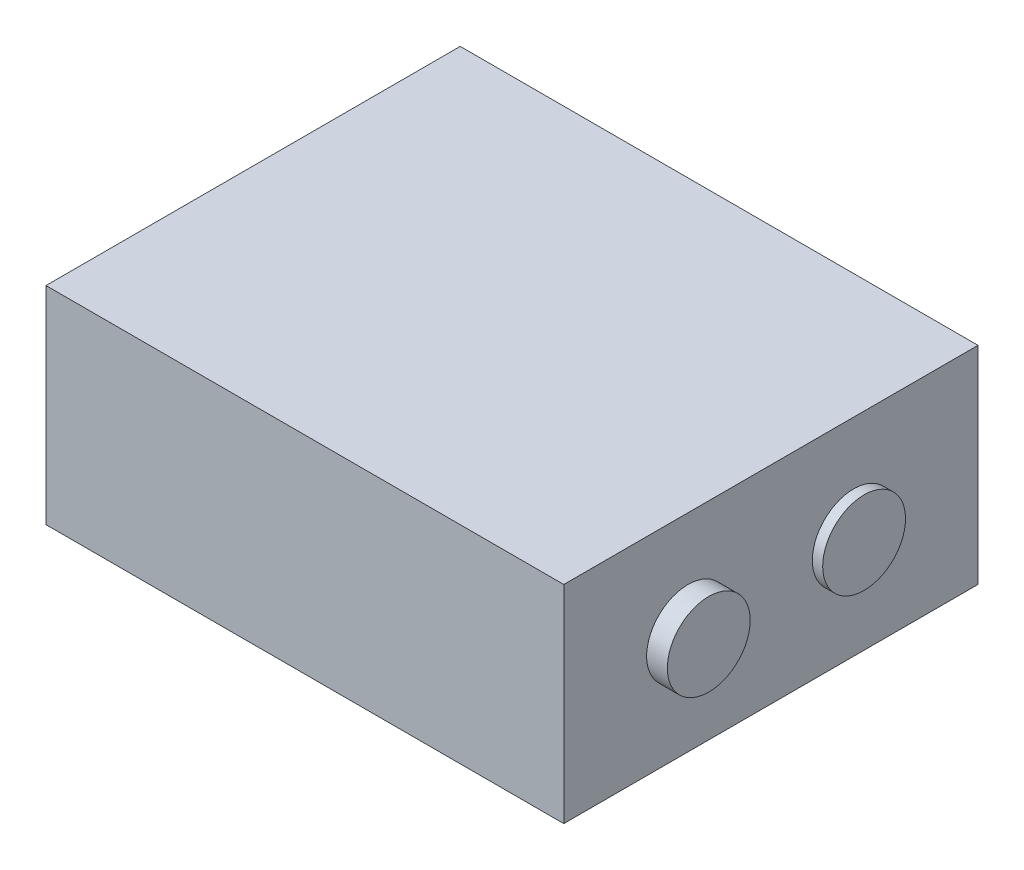
from build123d import *

# Parameters (mm, degrees)
SKETCH_2_W      = 500
SKETCH_2_H      = 400
EXTRUDE_1_DEPTH = 200
SKETCH_3_R      = 40
EXTRUDE_2_DEPTH = 10
SKETCH_3_3_R    = 40
EXTRUDE_3_DEPTH = 20


with BuildPart() as part:
    # 草图2 → 凸台-拉伸1 (new body)
    with BuildSketch(Plane(origin=(0, 0, 0), x_dir=(1, 0, 0), z_dir=(0, 1, 0))):
        Rectangle(SKETCH_2_W, SKETCH_2_H)
    extrude(amount=EXTRUDE_1_DEPTH)

    # 草图3 → 凸台-拉伸2 (add)
    with BuildSketch(Plane(origin=(250, 0, 0), x_dir=(0, 0, -1), z_dir=(1, 0, 0))):
        with Locations((80, 100)):
            Circle(SKETCH_3_R)
    extrude_2 = extrude(amount=EXTRUDE_2_DEPTH)

    # 草图3<3> → 凸台-拉伸3 (add)
    with BuildSketch(Plane(origin=(250, 0, 0), x_dir=(0, 0, -1), z_dir=(1, 0, 0))):
        with Locations((-80, 100)):
            Circle(SKETCH_3_3_R)
    extrude_3 = extrude(amount=EXTRUDE_3_DEPTH)

    # 镜向1: 凸台-拉伸2, 凸台-拉伸3 across plane
    add(extrude_2.mirror(Plane(origin=(0, 0, 0), x_dir=(0, 0, 1), z_dir=(1, 0, 0))))
    add(extrude_3.mirror(Plane(origin=(0, 0, 0), x_dir=(0, 0, 1), z_dir=(1, 0, 0))))


solid = part.part
